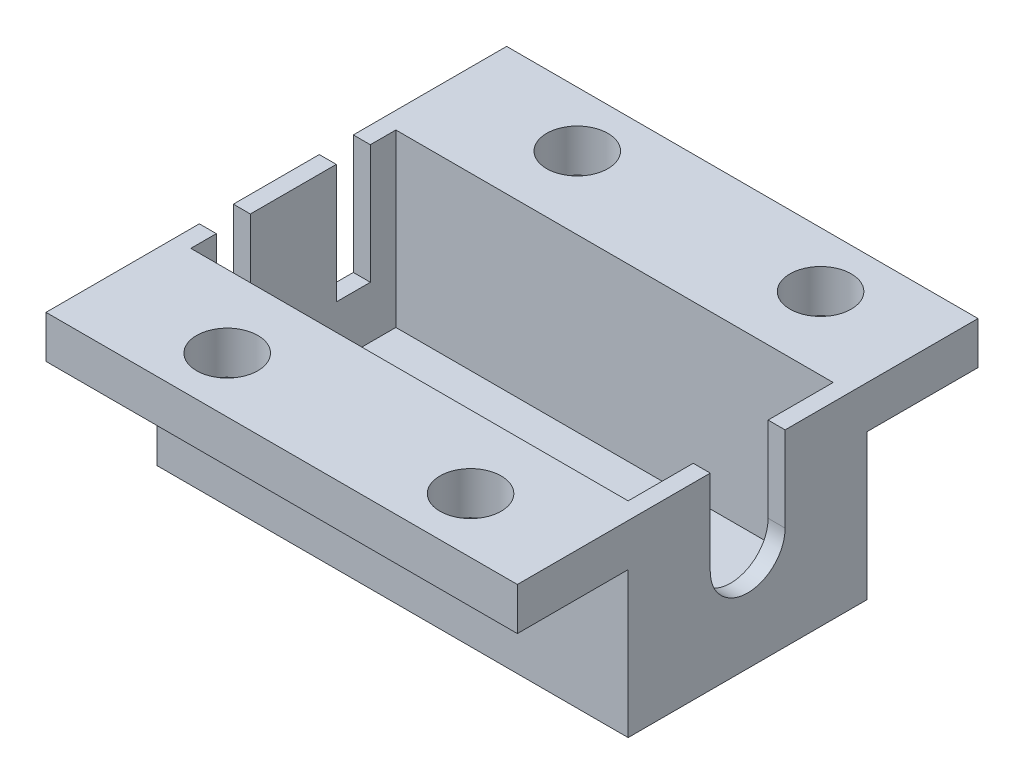
from build123d import *

# Parameters (mm, degrees)
SKETCH1_W            = 26.3
SKETCH1_H            = 14.05
BOSS_EXTRUDE6_DEPTH  = 1
SKETCH5_W            = 24.3
SKETCH5_H            = 1
BOSS_EXTRUDE8_DEPTH  = 10.05
SKETCH6_W            = 26.3
SKETCH6_H            = 27.07
SKETCH6_W_2          = 24.3
SKETCH6_H_2          = 12.05
BOSS_EXTRUDE9_DEPTH  = 2.5
SKETCH7_R            = 1.8
CUT_EXTRUDE1_DEPTH   = 2.5
SKETCH8_W            = 4.4
SKETCH8_H            = 5
CUT_EXTRUDE2_DEPTH   = 2.5
CUT_EXTRUDE3_DEPTH   = 2.5
SKETCH10_W           = 12
SKETCH10_H           = 8
CUT_EXTRUDE5_DEPTH   = 2.5
SKETCH11_W           = 2
SKETCH11_H           = 7
CUT_EXTRUDE7_DEPTH   = 2.5
SKETCH12_W           = 2
SKETCH12_H           = 3
BOSS_EXTRUDE11_DEPTH = 1
SKETCH13_W           = 2
SKETCH13_H           = 8
BOSS_EXTRUDE14_DEPTH = 1
SKETCH14_W           = 2
SKETCH14_H           = 4
BOSS_EXTRUDE15_DEPTH = 1.4
SKETCH15_W           = 12.05
SKETCH15_H           = 10.05
CUT_EXTRUDE8_DEPTH   = 1.4
SKETCH16_W           = 2
SKETCH16_H           = 3
CUT_EXTRUDE9_DEPTH   = 1.4


with BuildPart() as part:
    # Sketch1 → Boss-Extrude6 (new body)
    with BuildSketch(Plane(origin=(0, 0, 0), x_dir=(1, 0, 0), z_dir=(0, 1, 0))):
        with Locations((13.15, 7.025)):
            Rectangle(SKETCH1_W, SKETCH1_H)
    extrude(amount=BOSS_EXTRUDE6_DEPTH)

    # Sketch5 → Boss-Extrude8 (add)
    with BuildSketch(Plane(origin=(0, 1, 0), x_dir=(1, 0, 0), z_dir=(0, 1, 0))):
        with Locations((13.15, 13.55)):
            Rectangle(SKETCH5_W, SKETCH5_H)
        Polygon((26.3, 14.05), (25.3, 14.05), (25.3, 13.05), (25.3, 1), (25.3, 0), (26.3, 0), align=None)
        with Locations((13.15, 0.5)):
            Rectangle(SKETCH5_W, SKETCH5_H)
        Polygon((1, 14.05), (0, 14.05), (0, 0), (1, 0), (1, 1), (1, 13.05), align=None)
    extrude(amount=BOSS_EXTRUDE8_DEPTH)

    # Sketch6 → Boss-Extrude9 (add)
    with BuildSketch(Plane(origin=(0, 11.05, 0), x_dir=(1, 0, 0), z_dir=(0, 1, 0))):
        with Locations((13.15, 7.025)):
            Rectangle(SKETCH6_W, SKETCH6_H)
        with Locations((13.15, 7.025)):
            Rectangle(SKETCH6_W_2, SKETCH6_H_2, mode=Mode.SUBTRACT)
    extrude(amount=-BOSS_EXTRUDE9_DEPTH)

    # Sketch7 → Cut-Extrude1 (cut)
    with BuildSketch(Plane(origin=(0, 11.05, 0), x_dir=(1, 0, 0), z_dir=(0, 1, 0))):
        with Locations(Location((6, -3.26, 0), (0, 0, 270))):
            Circle(SKETCH7_R)
        with Locations(Location((20.3, -3.26, 0), (0, 0, 270))):
            Circle(SKETCH7_R)
        with Locations(Location((6, 17.31, 0), (0, 0, 270))):
            Circle(SKETCH7_R)
        with Locations(Location((20.3, 17.31, 0), (0, 0, 270))):
            Circle(SKETCH7_R)
    extrude(amount=-CUT_EXTRUDE1_DEPTH, mode=Mode.SUBTRACT)

    # Sketch8 → Cut-Extrude2 (cut)
    with BuildSketch(Plane(origin=(26.3, 0, 0), x_dir=(0, 0, -1), z_dir=(1, 0, 0))):
        with Locations((7.025, 8.55)):
            Rectangle(SKETCH8_W, SKETCH8_H)
    extrude(amount=-CUT_EXTRUDE2_DEPTH, mode=Mode.SUBTRACT)

    # Sketch9 → Cut-Extrude3 (cut)
    with BuildSketch(Plane(origin=(26.3, 0, 0), x_dir=(0, 0, -1), z_dir=(1, 0, 0))):
        with BuildLine():
            Line((9.225, 6.05), (4.825, 6.05))
            ThreePointArc((4.825, 6.05), (7.025, 3.85), (9.225, 6.05))
        make_face()
    extrude(amount=-CUT_EXTRUDE3_DEPTH, mode=Mode.SUBTRACT)

    # Sketch10 → Cut-Extrude5 (cut)
    with BuildSketch(Plane.XZ):
        with Locations((8.5, -7.025)):
            Rectangle(SKETCH10_W, SKETCH10_H)
    extrude(amount=-CUT_EXTRUDE5_DEPTH, mode=Mode.SUBTRACT)

    # Sketch11 → Cut-Extrude7 (cut)
    with BuildSketch(Plane.ZY):
        with Locations((-3.5, 7.55)):
            Rectangle(SKETCH11_W, SKETCH11_H)
        with Locations((-10.55, 7.55)):
            Rectangle(SKETCH11_W, SKETCH11_H)
    extrude(amount=-CUT_EXTRUDE7_DEPTH, mode=Mode.SUBTRACT)

    # Sketch12 → Boss-Extrude11 (add)
    with BuildSketch(Plane.ZY):
        with Locations((-3.5, 9.55)):
            Rectangle(SKETCH12_W, SKETCH12_H)
        with Locations((-10.55, 9.55)):
            Rectangle(SKETCH12_W, SKETCH12_H)
    extrude(amount=-BOSS_EXTRUDE11_DEPTH)

    # Sketch13 → Boss-Extrude14 (add)
    with BuildSketch(Plane.XZ):
        with Locations((3.5, -7.025)):
            Rectangle(SKETCH13_W, SKETCH13_H)
    extrude(amount=-BOSS_EXTRUDE14_DEPTH)

    # Sketch14 → Boss-Extrude15 (add)
    with BuildSketch(Plane.ZY):
        Polygon((-20.56, 8.55), (-14.05, 8.55), (-14.05, 0), (0, 0), (0, 8.55), (6.51, 8.55), (6.51, 11.05), (-20.56, 11.05), align=None)
        with Locations((-10.55, 6.05)):
            Rectangle(SKETCH14_W, SKETCH14_H, mode=Mode.SUBTRACT)
        with Locations((-3.5, 6.05)):
            Rectangle(SKETCH14_W, SKETCH14_H, mode=Mode.SUBTRACT)
    extrude(amount=BOSS_EXTRUDE15_DEPTH)

    # Sketch15 → Cut-Extrude8 (cut)
    with BuildSketch(Plane(origin=(1, 0, 0), x_dir=(0, 0, -1), z_dir=(1, 0, 0))):
        with Locations((7.025, 6.025)):
            Rectangle(SKETCH15_W, SKETCH15_H)
    extrude(amount=-CUT_EXTRUDE8_DEPTH, mode=Mode.SUBTRACT)

    # Sketch16 → Cut-Extrude9 (cut)
    with BuildSketch(Plane.ZY.offset(1.4)):
        with Locations((-10.55, 9.55)):
            Rectangle(SKETCH16_W, SKETCH16_H)
        with Locations((-3.5, 9.55)):
            Rectangle(SKETCH16_W, SKETCH16_H)
    extrude(amount=-CUT_EXTRUDE9_DEPTH, mode=Mode.SUBTRACT)


solid = part.part
